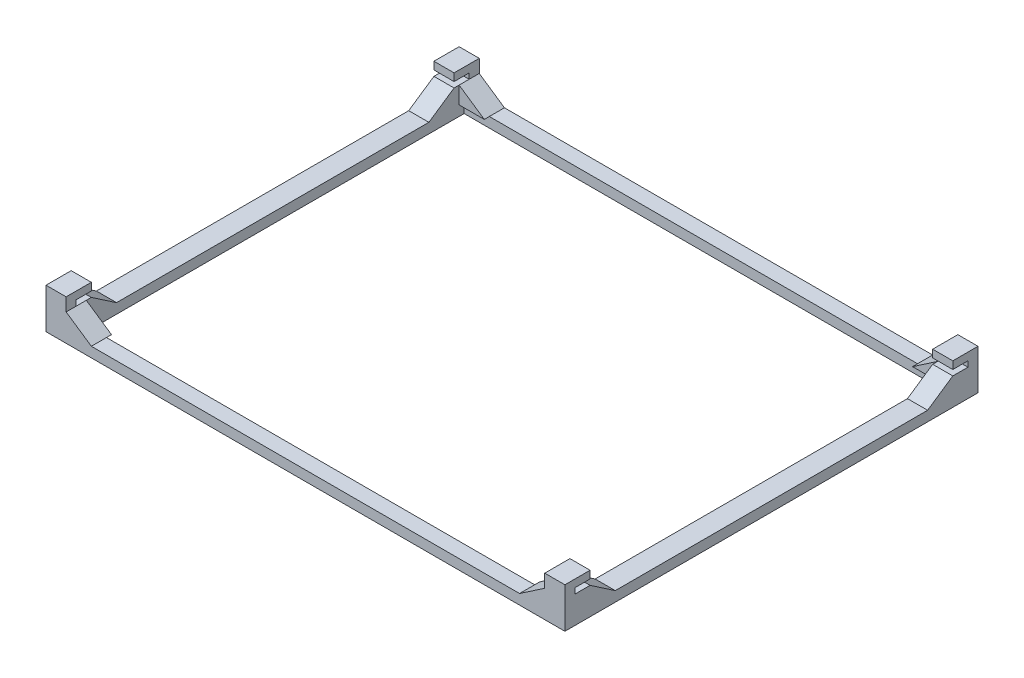
from build123d import *

# Parameters (mm, degrees)
SKETCH_1_W       = 103
SKETCH_1_H       = 82
SKETCH_1_W_2     = 95
SKETCH_1_H_2     = 76
EXTRUDE_2_DEPTH  = 2
EXTRUDE_3_DEPTH  = 4
EXTRUDE_4_DEPTH  = 4
EXTRUDE_5_DEPTH  = 4
EXTRUDE_6_DEPTH  = 4
EXTRUDE_7_DEPTH  = 4
EXTRUDE_8_DEPTH  = 4
EXTRUDE_9_DEPTH  = 4
EXTRUDE_10_DEPTH = 4


with BuildPart() as part:
    # Эскиз1 → Бобышка-Вытянуть2 (new body)
    with BuildSketch(Plane(origin=(0, 0, 0), x_dir=(1, 0, 0), z_dir=(0, 1, 0))):
        Rectangle(SKETCH_1_W, SKETCH_1_H)
        Rectangle(SKETCH_1_W_2, SKETCH_1_H_2, mode=Mode.SUBTRACT)
    extrude(amount=EXTRUDE_2_DEPTH)

    # Эскиз6 → Бобышка-Вытянуть3 (add)
    with BuildSketch(Plane(origin=(51.5, 0, 0), x_dir=(0, 0, -1), z_dir=(1, 0, 0))):
        Polygon((31, 2), (36, 2), (36, 5.4), align=None)
        Polygon((36, 2), (41, 2), (41, 8), (36, 8), (36, 6.5), (39, 6.5), (39, 5.4), (36, 5.4), align=None)
    extrude(amount=-EXTRUDE_3_DEPTH)

    # Эскиз7 → Бобышка-Вытянуть4 (add)
    with BuildSketch(Plane(origin=(51.5, 0, 0), x_dir=(0, 0, -1), z_dir=(1, 0, 0))):
        Polygon((-41, 8), (-41, 2), (-36, 2), (-36, 5.4), (-39, 5.4), (-39, 6.5), (-36, 6.5), (-36, 8), align=None)
        Polygon((-36, 5.4), (-36, 2), (-31, 2), align=None)
    extrude(amount=-EXTRUDE_4_DEPTH)

    # Эскиз9 → Бобышка-Вытянуть5 (add)
    with BuildSketch(Plane.ZY.offset(51.5)):
        Polygon((-41, 8), (-41, 2), (-36, 2), (-36, 5.4), (-39, 5.4), (-39, 6.5), (-36, 6.5), (-36, 8), align=None)
        Polygon((-36, 5.4), (-36, 2), (-31, 2), align=None)
    extrude(amount=-EXTRUDE_5_DEPTH)

    # Эскиз10 → Бобышка-Вытянуть6 (add)
    with BuildSketch(Plane.ZY.offset(51.5)):
        Polygon((36, 2), (41, 2), (41, 8), (36, 8), (36, 6.5), (39, 6.5), (39, 5.4), (36, 5.4), align=None)
        Polygon((31, 2), (36, 2), (36, 5.4), align=None)
    extrude(amount=-EXTRUDE_6_DEPTH)

    # Эскиз11 → Бобышка-Вытянуть7 (add)
    with BuildSketch(Plane.XY.offset(41)):
        Polygon((-47.5, 2), (-47.5, 5.4), (-42.5, 2), align=None)
    extrude(amount=-EXTRUDE_7_DEPTH)

    # Эскиз12 → Бобышка-Вытянуть8 (add)
    with BuildSketch(Plane.XY.offset(41)):
        Polygon((47.5, 2), (47.5, 5.4), (42.5, 2), align=None)
    extrude(amount=-EXTRUDE_8_DEPTH)

    # Эскиз13 → Бобышка-Вытянуть9 (add)
    with BuildSketch(Plane(origin=(0, 0, -41), x_dir=(-1, 0, 0), z_dir=(0, 0, -1))):
        Polygon((-47.5, 2), (-47.5, 5.4), (-42.5, 2), align=None)
    extrude(amount=-EXTRUDE_9_DEPTH)

    # Эскиз14 → Бобышка-Вытянуть10 (add)
    with BuildSketch(Plane(origin=(0, 0, -41), x_dir=(-1, 0, 0), z_dir=(0, 0, -1))):
        Polygon((47.5, 2), (47.5, 5.4), (42.5, 2), align=None)
    extrude(amount=-EXTRUDE_10_DEPTH)


solid = part.part
